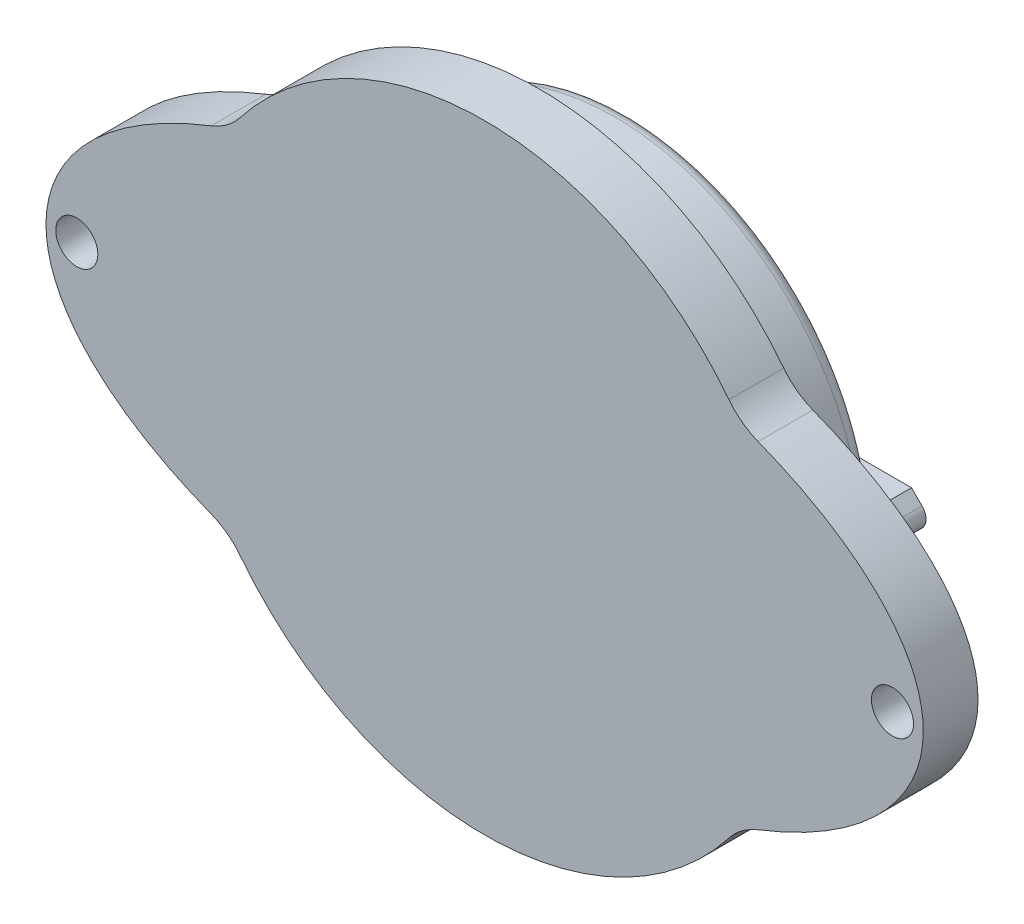
from build123d import *

# Parameters (mm, degrees)
SKETCH1_R           = 1.537908455
BOSS_EXTRUDE1_DEPTH = 4
SKETCH2_R           = 20.698021895
SKETCH2_R_2         = 20.1
CUT_EXTRUDE1_DEPTH  = 1
SKETCH3_R           = 12.92497531
BOSS_EXTRUDE2_DEPTH = 0.5
SKETCH4_R           = 18.103513597
BOSS_EXTRUDE3_DEPTH = 6
FILLET1_R           = 1
BOSS_EXTRUDE4_DEPTH = 3
SCALE2_SCALE        = 0.5
SCALE3_SCALE        = 0.5


with BuildPart() as part:
    # Sketch1 → Boss-Extrude1 (new body)
    with BuildSketch(Plane.XY):
        with BuildLine():
            ThreePointArc((-17.85861924, -13.874920024), (0, -22.615120756), (17.85861924, -13.874920024))
            ThreePointArc((17.85861924, -13.874920024), (18.815427461, -12.936233048), (19.987223835, -12.285457765))
            add(Edge.make_bspline(
                [(19.987223835, -12.285457765), (51.427576939, 0), (19.987223835, 12.285457765)],
                knots=[5.385493495, 5.385493495, 5.385493495, 7.180877119, 7.180877119, 7.180877119], degree=2, weights=[1, 0.623416377, 1]))
            ThreePointArc((19.987223835, 12.285457765), (18.815427461, 12.936233048), (17.85861924, 13.874920024))
            ThreePointArc((17.85861924, 13.874920024), (0, 22.615120756), (-17.85861924, 13.874920024))
            ThreePointArc((-17.85861924, 13.874920024), (-18.815427461, 12.936233048), (-19.987223835, 12.285457765))
            add(Edge.make_bspline(
                [(-19.987223835, 12.285457765), (-51.427576939, 0), (-19.987223835, -12.285457765)],
                knots=[2.243900842, 2.243900842, 2.243900842, 4.039284465, 4.039284465, 4.039284465], degree=2, weights=[1, 0.623416377, 1]))
            ThreePointArc((-19.987223835, -12.285457765), (-18.815427461, -12.936233048), (-17.85861924, -13.874920024))
        make_face()
        with Locations((-29.809246855, 0)):
            Circle(SKETCH1_R, mode=Mode.SUBTRACT)
        with Locations((29.809246855, 0.098164369)):
            Circle(SKETCH1_R, mode=Mode.SUBTRACT)
    extrude(amount=BOSS_EXTRUDE1_DEPTH)

    # Sketch2 → Cut-Extrude1 (cut)
    with BuildSketch(Plane(origin=(0, 0, 0), x_dir=(-1, 0, 0), z_dir=(0, 0, -1))):
        Circle(SKETCH2_R)
        Circle(SKETCH2_R_2, mode=Mode.SUBTRACT)
    extrude(amount=-CUT_EXTRUDE1_DEPTH, mode=Mode.SUBTRACT)

    # Sketch3 → Boss-Extrude2 (add)
    with BuildSketch(Plane(origin=(0, 0, 0), x_dir=(-1, 0, 0), z_dir=(0, 0, -1))):
        Circle(SKETCH3_R)
    extrude(amount=BOSS_EXTRUDE2_DEPTH)

    # Sketch4 → Boss-Extrude3 (add)
    with BuildSketch(Plane(origin=(0, 0, -0.5), x_dir=(-1, 0, 0), z_dir=(0, 0, -1))):
        Circle(SKETCH4_R)
    extrude(amount=BOSS_EXTRUDE3_DEPTH)

    # Fillet1
    fillet1_edges = [part.edges().sort_by_distance(p)[0] for p in [
        (18.103513597, 0, -6.5),
    ]]
    fillet(fillet1_edges, radius=FILLET1_R)

    # Sketch5 → Boss-Extrude4 (add)
    with BuildSketch(Plane(origin=(0, 0, -6.5), x_dir=(-1, 0, 0), z_dir=(0, 0, -1))):
        with BuildLine():
            Line((-4.025670138, 1.472465542), (-17.702307957, 1.472465542))
            Line((-17.702307957, 1.472465542), (-18.467666717, 0.707106781))
            ThreePointArc((-18.467666717, 0.707106781), (-18.760559936, 0), (-18.467666717, -0.707106781))
            Line((-18.467666717, -0.707106781), (-17.702307957, -1.472465542))
            Line((-17.702307957, -1.472465542), (-4.025670138, -1.472465542))
            ThreePointArc((-4.025670138, -1.472465542), (0, -4.286510799), (4.025670138, -1.472465542))
            Line((4.025670138, -1.472465542), (17.636865044, -1.472465542))
            Line((17.636865044, -1.472465542), (18.402223804, -0.707106781))
            ThreePointArc((18.402223804, -0.707106781), (18.695117023, 0), (18.402223804, 0.707106781))
            Line((18.402223804, 0.707106781), (17.636865044, 1.472465542))
            Line((17.636865044, 1.472465542), (4.025670138, 1.472465542))
            ThreePointArc((4.025670138, 1.472465542), (0, 4.286510799), (-4.025670138, 1.472465542))
        make_face()
    extrude(amount=BOSS_EXTRUDE4_DEPTH)


with BuildPart() as part_1:
    # Scale2: scaled about (0, 0, 0)
    add(part.part.scale(SCALE2_SCALE))


with BuildPart() as part_2:
    # Scale3: scaled about (0, 0, 0)
    add(part_1.part.scale(SCALE3_SCALE))


solid = part_2.part
